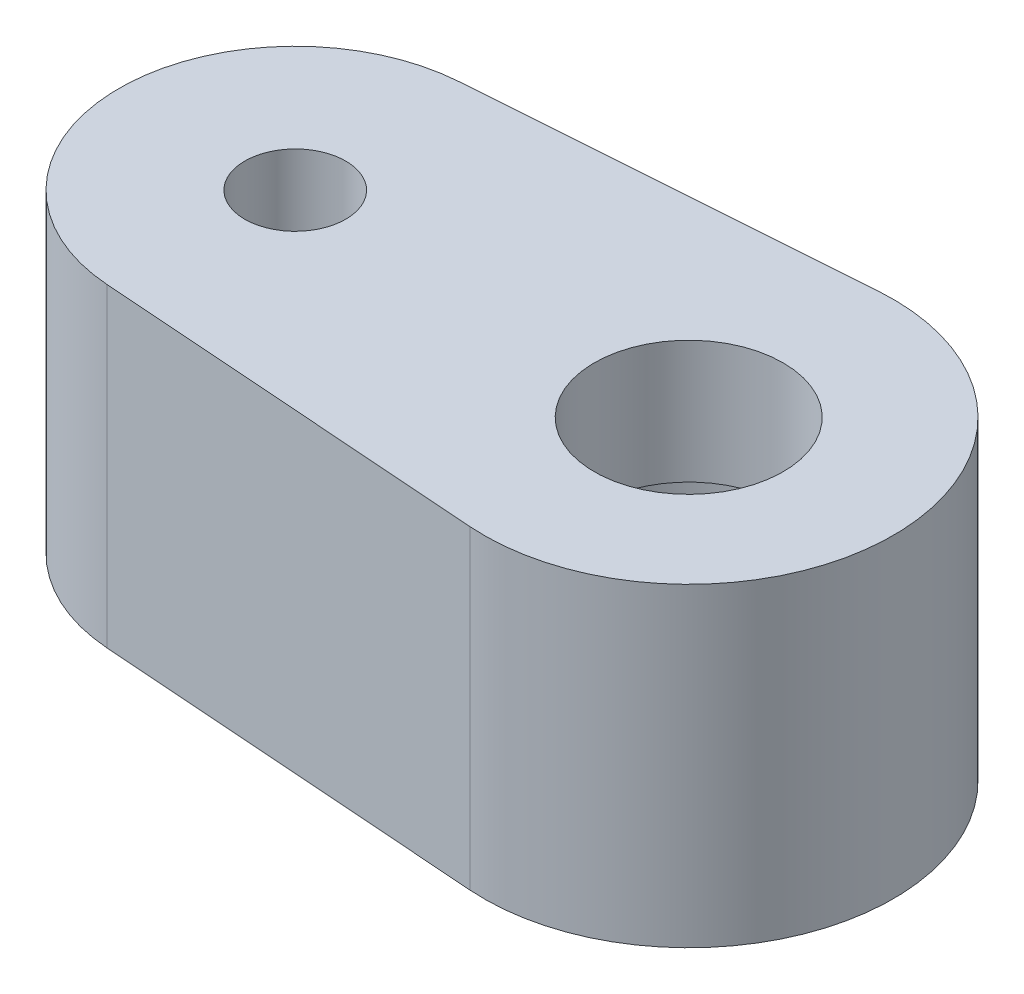
from build123d import *

# Parameters (mm, degrees)
BOSS_EXTRUDE1_DEPTH      = 1
BOSS_EXTRUDE1_DEPTH_BACK = 1
CUT_EXTRUDE1_REACH       = 6.335
SKETCH5_R                = 0.3207


with BuildPart() as part:
    # Sketch1 → Boss-Extrude1 (new, two sides: drawn at the far end of the back side and taken through both)
    with BuildSketch(Plane(origin=(0, 0, 0), x_dir=(1, 0, 0), z_dir=(0, 1, 0)).offset(-BOSS_EXTRUDE1_DEPTH_BACK)):
        with BuildLine():
            Line((-2.58064, 1.117093188), (-0.0936, 1.296626022))
            ThreePointArc((-0.0936, 1.296626022), (1.3, 0), (-0.0936, -1.296626022))
            Line((-0.0936, -1.296626022), (-2.58064, -1.117093188))
            ThreePointArc((-2.58064, -1.117093188), (-3.62, 0), (-2.58064, 1.117093188))
        make_face()
    extrude(amount=BOSS_EXTRUDE1_DEPTH + BOSS_EXTRUDE1_DEPTH_BACK)

    # Sketch4 → Cut-Revolve1 (revolve, cut)
    with BuildSketch(Plane.XY):
        Polygon((0.85, 0), (0.85, 0.075), (0.6, 0.219337567), (0.6, 1), (0, 1), (0, -1), (0.6, -1), (0.6, -0.219337567), (0.85, -0.075), align=None)
    revolve(axis=Axis((0, -1, 0), (0, 1, 0)), mode=Mode.SUBTRACT)

    # Sketch5 → Cut-Extrude1 (cut, up to next)
    with BuildSketch(Plane(origin=(0, 1, 0), x_dir=(1, 0, 0), z_dir=(0, 1, 0)), mode=Mode.PRIVATE) as cut_extrude1_sk1:
        with Locations((-2.5, 0)):
            Circle(SKETCH5_R)
    cut_extrude1_tool1 = extrude(cut_extrude1_sk1.sketch, amount=-CUT_EXTRUDE1_REACH, mode=Mode.PRIVATE) & part.part
    add(cut_extrude1_tool1.solids().sort_by_distance((-2.5, 1, 0))[0], mode=Mode.SUBTRACT)


solid = part.part
